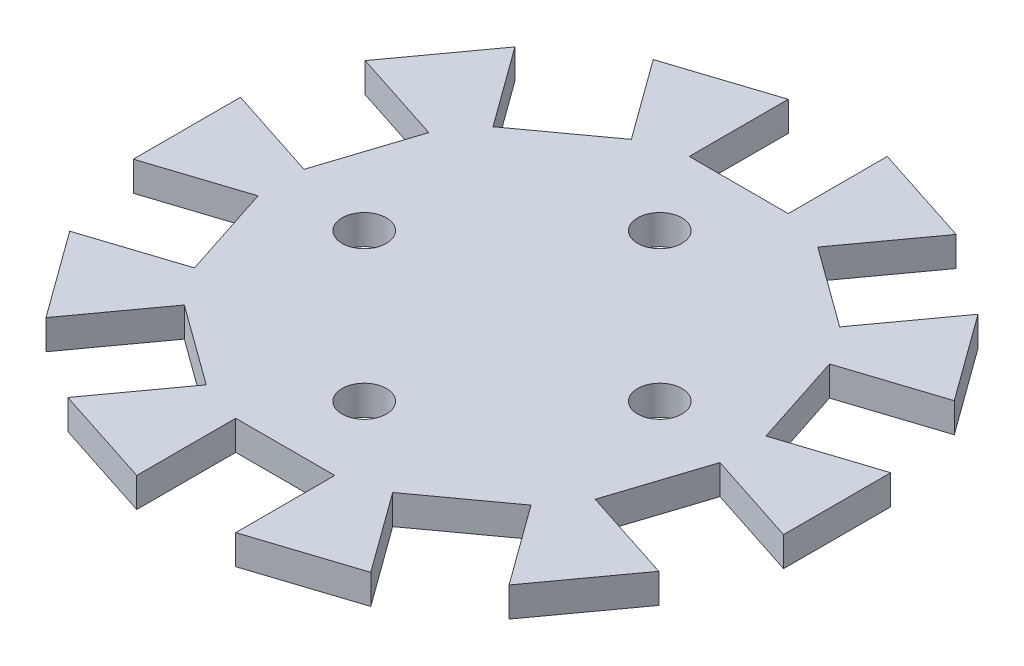
from build123d import *

# Parameters (mm, degrees)
BOSS_EXTRUDE1_DEPTH = 2
CUT_EXTRUDE1_DEPTH  = 2
SKETCH7_R           = 1.5
CUT_EXTRUDE3_DEPTH  = 2


with BuildPart() as part:
    # Sketch1 → Boss-Extrude1 (new body)
    with BuildSketch(Plane(origin=(0, 0, 0), x_dir=(1, 0, 0), z_dir=(0, 1, 0))):
        Polygon((0, 23.132168933), (-13.596747752, 18.714317784), (-22, 7.148233317), (-22, -7.148233317), (-13.596747752, -18.714317784), (0, -23.132168933), (13.596747752, -18.714317784), (22, -7.148233317), (22, 7.148233317), (13.596747752, 18.714317784), align=None)
    extrude(amount=BOSS_EXTRUDE1_DEPTH)

    # Sketch2 → Cut-Extrude1 (cut)
    with BuildSketch(Plane(origin=(0, 2, 0), x_dir=(1, 0, 0), z_dir=(0, 1, 0))):
        Polygon((0, 23.132168933), (-3.35, 22.043687951), (-3.35, 15.343687951), (3.35, 15.343687951), (3.35, 22.043687951), align=None)
        Polygon((11.729000424, 10.444223713), (15.667161615, 15.864637576), (13.596747752, 18.714317784), (10.246747752, 19.802798766), (6.308586562, 14.382384904), align=None)
        Polygon((15.627921341, 1.555421004), (22, 3.625834866), (22, 7.148233317), (19.929586138, 9.997913525), (13.557507479, 7.927499663), align=None)
        Polygon((13.557507479, -7.927499663), (19.929586138, -9.997913525), (22, -7.148233317), (22, -3.625834866), (15.627921341, -1.555421004), align=None)
        Polygon((6.308586562, -14.382384904), (10.246747752, -19.802798766), (13.596747752, -18.714317784), (15.667161615, -15.864637576), (11.729000424, -10.444223713), align=None)
        Polygon((-3.35, -15.343687951), (-3.35, -22.043687951), (0, -23.132168933), (3.35, -22.043687951), (3.35, -15.343687951), align=None)
        Polygon((-11.729000424, -10.444223713), (-15.667161615, -15.864637576), (-13.596747752, -18.714317784), (-10.246747752, -19.802798766), (-6.308586562, -14.382384904), align=None)
        Polygon((-15.627921341, -1.555421004), (-22, -3.625834866), (-22, -7.148233317), (-19.929586138, -9.997913525), (-13.557507479, -7.927499663), align=None)
        Polygon((-13.557507479, 7.927499663), (-19.929586138, 9.997913525), (-22, 7.148233317), (-22, 3.625834866), (-15.627921341, 1.555421004), align=None)
        Polygon((-6.308586562, 14.382384904), (-10.246747752, 19.802798766), (-13.596747752, 18.714317784), (-15.667161615, 15.864637576), (-11.729000424, 10.444223713), align=None)
    extrude(amount=-CUT_EXTRUDE1_DEPTH, mode=Mode.SUBTRACT)

    # Sketch7 → Cut-Extrude3 (cut)
    with BuildSketch(Plane(origin=(0, 2, 0), x_dir=(1, 0, 0), z_dir=(0, 1, 0))):
        with Locations(Location((0, 10, 0), (0, 0, 270))):
            Circle(SKETCH7_R)
        with Locations(Location((10, 0, 0), (0, 0, 270))):
            Circle(SKETCH7_R)
        with Locations(Location((0, -10, 0), (0, 0, 270))):
            Circle(SKETCH7_R)
        with Locations(Location((-10, 0, 0), (0, 0, 270))):
            Circle(SKETCH7_R)
    extrude(amount=-CUT_EXTRUDE3_DEPTH, mode=Mode.SUBTRACT)


solid = part.part
